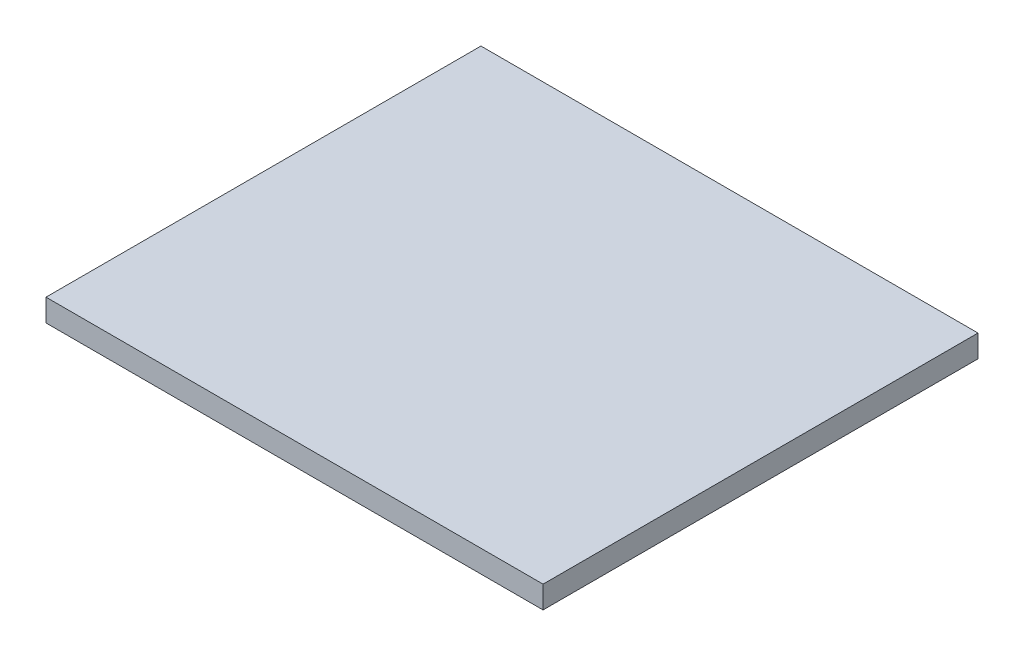
from build123d import *

# Parameters (mm, degrees)
ESQUISSE1_W        = 400
ESQUISSE1_H        = 350
BOSS_EXTRU_1_DEPTH = 18


with BuildPart() as part:
    # Esquisse1 → Boss.-Extru.1 (new body)
    with BuildSketch(Plane(origin=(0, 0, 0), x_dir=(1, 0, 0), z_dir=(0, 1, 0))):
        Rectangle(ESQUISSE1_W, ESQUISSE1_H)
    extrude(amount=BOSS_EXTRU_1_DEPTH)


solid = part.part
